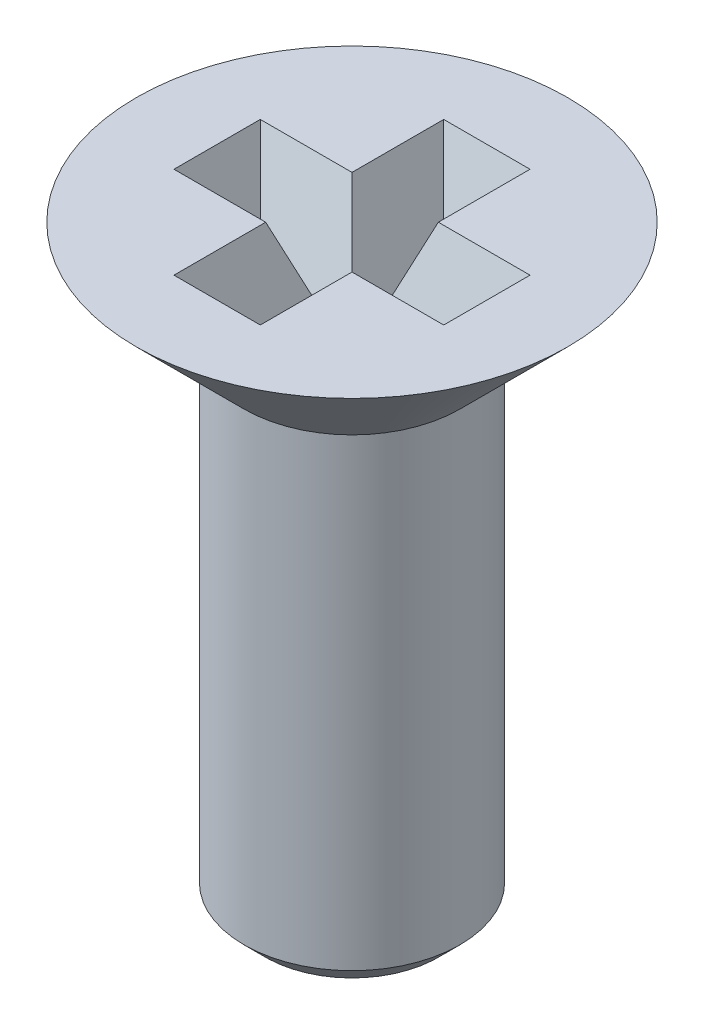
from build123d import *

# Parameters (mm, degrees)
CHAMFER1_SIZE               = 0.2
SKETCH2_W                   = 2.5
SKETCH2_H                   = 0.8
CUT_EXTRUDE1_DEPTH          = 1
CUT_EXTRUDE1_DRAFT          = -20
CIRPATTERN1_COPY_1_SKETCH_W = 2.5
CIRPATTERN1_COPY_1_SKETCH_H = 0.8
CIRPATTERN1_COPY_1_DEPTH    = 1
CIRPATTERN1_COPY_1_DRAFT    = -20


with BuildPart() as part:
    # Sketch1 → Revolve1 (revolve)
    with BuildSketch(Plane.XY):
        Polygon((0, 0), (1, 0), (1, 4.5), (2, 5.5), (0, 5.5), align=None)
    revolve(axis=Axis((0, 5.5, 0), (0, -1, 0)))

    # Chamfer1
    chamfer1_edges = [part.edges().sort_by_distance(p)[0] for p in [
        (-1, 0, 0),
    ]]
    chamfer(chamfer1_edges, length=CHAMFER1_SIZE)


with BuildPart() as cut_extrude1_tool:
    # Sketch2 → Cut-Extrude1 (with draft: the straight prism first)
    with BuildSketch(Plane(origin=(0, 5.5, 0), x_dir=(1, 0, 0), z_dir=(0, 1, 0))):
        Rectangle(SKETCH2_W, SKETCH2_H)
    extrude(amount=-CUT_EXTRUDE1_DEPTH)
    # Cut-Extrude1: the draft: its side faces are tilted about the plane it starts from
    cut_extrude1_sides = [cut_extrude1_tool.faces().sort_by_distance(p)[0] for p in [
        (0, 5, 0.4),
        (1.25, 5, 0),
        (0, 5, -0.4),
        (-1.25, 5, 0),
    ]]
    draft(cut_extrude1_sides, Plane(origin=(0, 5.5, 0), x_dir=(1, 0, 0), z_dir=(0, 1, 0)), CUT_EXTRUDE1_DRAFT)


with BuildPart() as part_1:
    add(part.part)

    # Cut-Extrude1: cut by cut_extrude1_tool
    add(cut_extrude1_tool.part, mode=Mode.SUBTRACT)


with BuildPart() as cirpattern1_copy_1_tool:
    # CirPattern1 copy 1 sketch → CirPattern1 copy 1 (with draft: the straight prism first)
    with BuildSketch(Plane(origin=(0, 5.5, 0), x_dir=(0, 0, -1), z_dir=(0, 1, 0))):
        Rectangle(CIRPATTERN1_COPY_1_SKETCH_W, CIRPATTERN1_COPY_1_SKETCH_H)
    extrude(amount=-CIRPATTERN1_COPY_1_DEPTH)
    # CirPattern1 copy 1: the draft: its side faces are tilted about the plane it starts from
    cirpattern1_copy_1_sides = [cirpattern1_copy_1_tool.faces().sort_by_distance(p)[0] for p in [
        (0.4, 5, 0),
        (0, 5, -1.25),
        (-0.4, 5, 0),
        (0, 5, 1.25),
    ]]
    draft(cirpattern1_copy_1_sides, Plane(origin=(0, 5.5, 0), x_dir=(0, 0, -1), z_dir=(0, 1, 0)), CIRPATTERN1_COPY_1_DRAFT)


with BuildPart() as part_2:
    add(part_1.part)

    # CirPattern1 copy 1: cut by cirpattern1_copy_1_tool
    add(cirpattern1_copy_1_tool.part, mode=Mode.SUBTRACT)


solid = part_2.part
